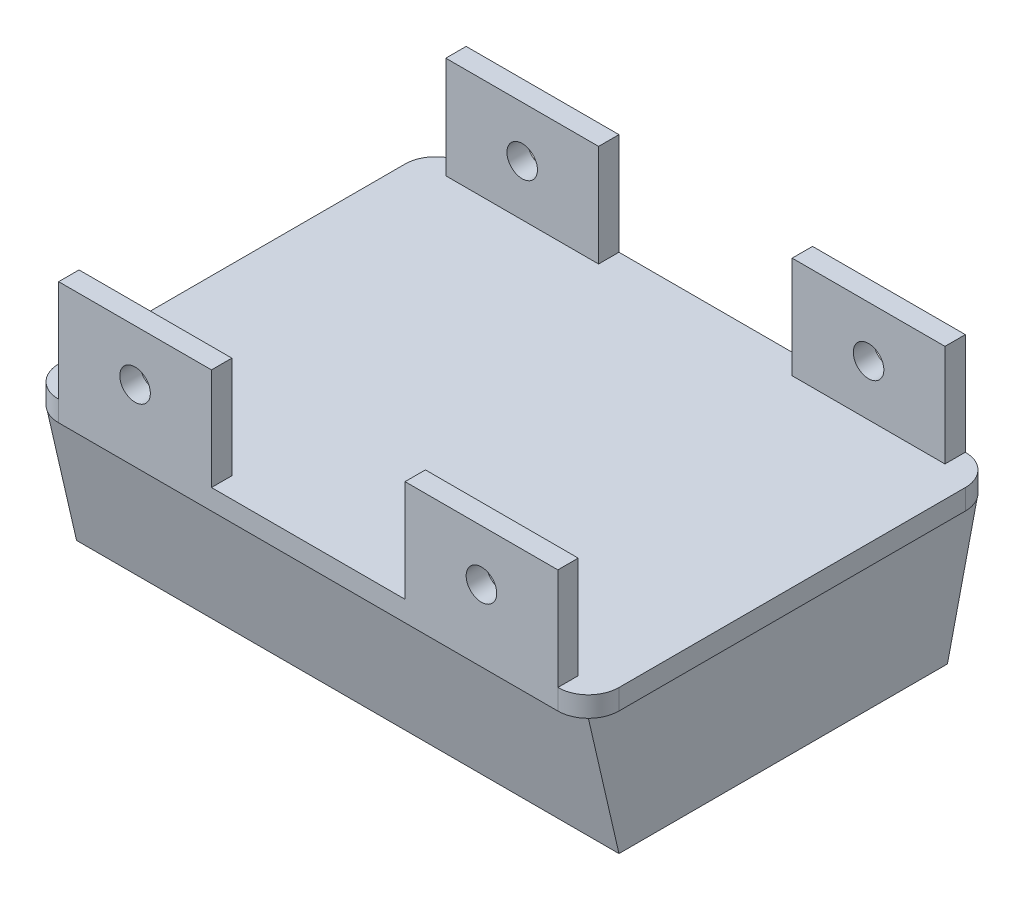
from build123d import *

# Parameters (mm, degrees)
SKETCH1_W           = 55
SKETCH1_H           = 40
BOSS_EXTRUDE1_DEPTH = 2
SKETCH3_W           = 15
SKETCH3_H           = 2
BOSS_EXTRUDE2_DEPTH = 10
FILLET1_R           = 3
FILLET2_R           = 3
FILLET3_R           = 3
FILLET4_R           = 3
SKETCH4_R           = 1.5
CUT_EXTRUDE1_DEPTH  = 50
SKETCH5_W           = 53.242640687
SKETCH5_H           = 38.242640688
BOSS_EXTRUDE3_DEPTH = 13
CUT_EXTRUDE2_DEPTH  = 61.469324671
SKETCH7_R           = 0.75
BOSS_EXTRUDE4_DEPTH = 4


with BuildPart() as part:
    # Sketch1 → Boss-Extrude1 (new body)
    with BuildSketch(Plane(origin=(0, 0, 0), x_dir=(1, 0, 0), z_dir=(0, 1, 0))):
        with Locations((-17.80952381, -3.630952381)):
            Rectangle(SKETCH1_W, SKETCH1_H)
    extrude(amount=BOSS_EXTRUDE1_DEPTH)

    # Sketch3 → Boss-Extrude2 (add)
    with BuildSketch(Plane(origin=(0, 2, 0), x_dir=(1, 0, 0), z_dir=(0, 1, 0))):
        with Locations((-34.80952381, 15.369047619)):
            Rectangle(SKETCH3_W, SKETCH3_H)
        with Locations((-34.80952381, -22.630952381)):
            Rectangle(SKETCH3_W, SKETCH3_H)
        with Locations((-0.80952381, -22.630952381)):
            Rectangle(SKETCH3_W, SKETCH3_H)
        with Locations((-0.80952381, 15.369047619)):
            Rectangle(SKETCH3_W, SKETCH3_H)
    extrude(amount=BOSS_EXTRUDE2_DEPTH)

    # Fillet1
    fillet1_edges = [part.edges().sort_by_distance(p)[0] for p in [
        (-45.30952381, 1, -16.369047619),
    ]]
    fillet(fillet1_edges, radius=FILLET1_R)

    # Fillet2
    fillet2_edges = [part.edges().sort_by_distance(p)[0] for p in [
        (-45.30952381, 1, 23.630952381),
    ]]
    fillet(fillet2_edges, radius=FILLET2_R)

    # Fillet3
    fillet3_edges = [part.edges().sort_by_distance(p)[0] for p in [
        (9.69047619, 1, -16.369047619),
    ]]
    fillet(fillet3_edges, radius=FILLET3_R)

    # Fillet4
    fillet4_edges = [part.edges().sort_by_distance(p)[0] for p in [
        (9.69047619, 1, 23.630952381),
    ]]
    fillet(fillet4_edges, radius=FILLET4_R)

    # Sketch4 → Cut-Extrude1 (cut)
    with BuildSketch(Plane.XY.offset(23.630952381)):
        with Locations((-0.80952381, 7)):
            Circle(SKETCH4_R)
        with Locations((-34.80952381, 7)):
            Circle(SKETCH4_R)
    extrude(amount=-CUT_EXTRUDE1_DEPTH, mode=Mode.SUBTRACT)

    # Sketch5 → Boss-Extrude3 (add)
    with BuildSketch(Plane.XZ):
        with Locations((-17.809523809, 3.630952381)):
            Rectangle(SKETCH5_W, SKETCH5_H)
    extrude(amount=BOSS_EXTRUDE3_DEPTH)

    # Sketch6 → Cut-Extrude2 (cut, through all)
    with BuildSketch(Plane.ZY.offset(44.430844153)):
        Polygon((-15.490367963, -13), (-12.490367963, -13), (-15.490367963, 0), align=None)
        Polygon((19.752272725, -13), (22.752272725, 0), (22.752272725, -13), align=None)
    extrude(amount=-CUT_EXTRUDE2_DEPTH, mode=Mode.SUBTRACT)

    # Sketch7 → Boss-Extrude4 (add)
    with BuildSketch(Plane.XZ.offset(13)):
        with Locations(Location((-17.80952381, 3.630952381, 0), (0, 0, 90))):
            Circle(SKETCH7_R)
    extrude(amount=BOSS_EXTRUDE4_DEPTH)


solid = part.part
